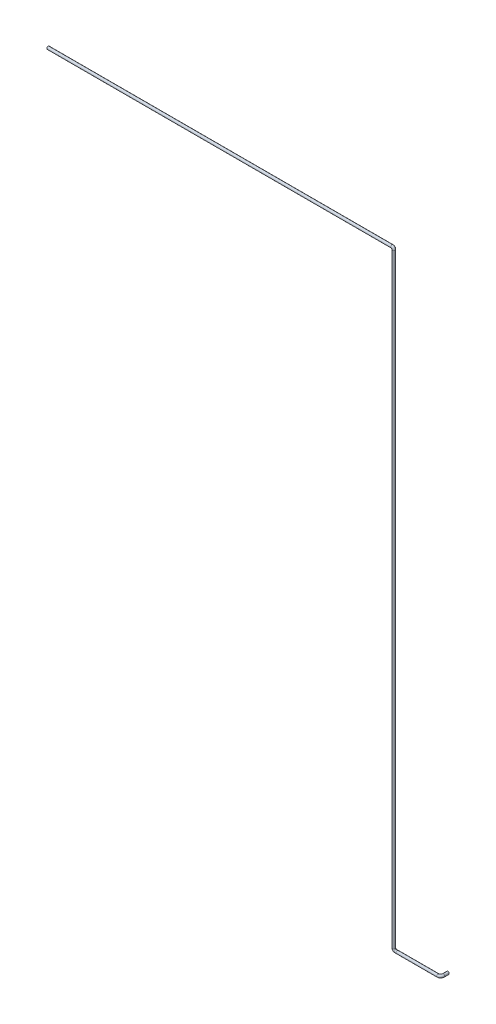
from build123d import *

# Parameters (mm, degrees)
SKETCH1_R   = 9.525
SKETCH1_R_2 = 6.985


with BuildPart() as part:
    # Sweep1: sweep along a curve in space
    with BuildLine() as sweep1_path:
        Line((0, 0, 0), (0, 0, 31.75))
        ThreePointArc((0, 0, 31.75), (-5.579615818, 0, 45.220384182), (-19.05, 0, 50.8))
        Line((-19.05, 0, 50.8), (-304.8, 0, 50.8))
        Line((-304.8, 0, 50.8), (-317.5, 0, 50.8))
        ThreePointArc((-317.5, 0, 50.8), (-326.480256121, 3.719743879, 50.8), (-330.2, 12.7, 50.8))
        Line((-330.2, 12.7, 50.8), (-330.2, 4279.9, 50.8))
        ThreePointArc((-330.2, 4279.9, 50.8), (-333.919743879, 4288.880256121, 50.8), (-342.9, 4292.6, 50.8))
        Line((-342.9, 4292.6, 50.8), (-2768.6, 4292.6, 50.8))
    # Sketch1 → Sweep1 (sweep)
    with BuildSketch(Plane.XY):
        Circle(SKETCH1_R)
        Circle(SKETCH1_R_2, mode=Mode.SUBTRACT)
    sweep(path=sweep1_path.line)


solid = part.part
